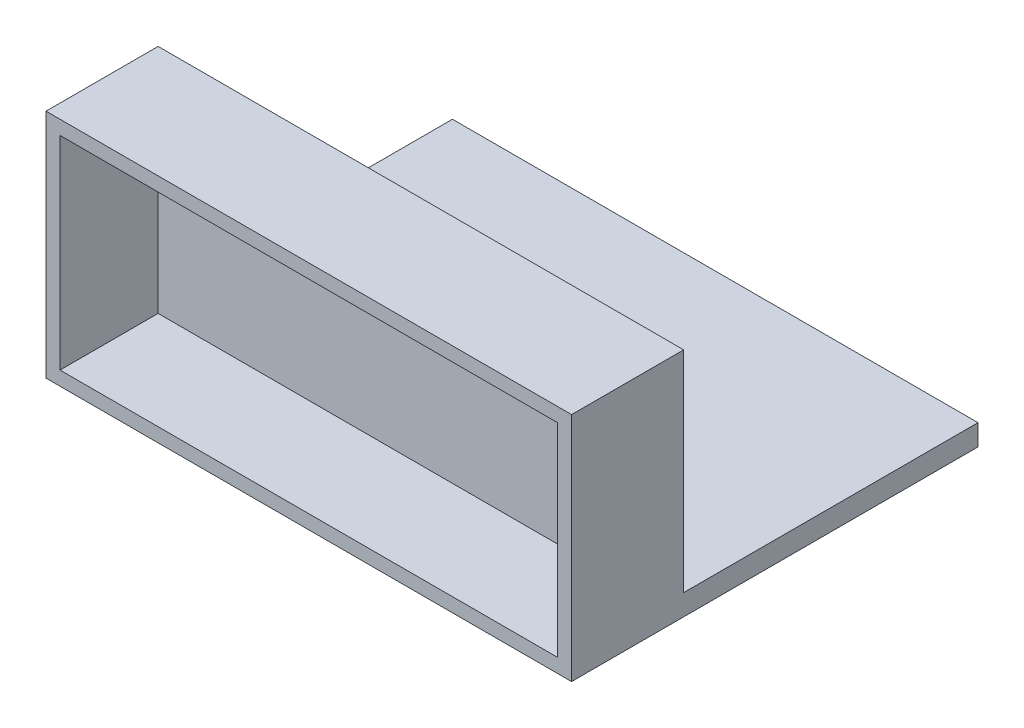
from build123d import *

# Parameters (mm, degrees)
SKETCH1_W           = 150
SKETCH1_H           = 112
BOSS_EXTRUDE1_DEPTH = 6
SKETCH3_W           = 150
SKETCH3_H           = 6
BOSS_EXTRUDE2_DEPTH = 8
SKETCH4_W           = 150
SKETCH4_H           = 4
BOSS_EXTRUDE3_DEPTH = 8
SKETCH6_W           = 150
SKETCH6_H           = 36
BOSS_EXTRUDE4_DEPTH = 60
CUT_EXTRUDE1_START  = -4
SKETCH7_W           = 150
SKETCH7_H           = 74
CUT_EXTRUDE1_DEPTH  = 4
SKETCH8_W           = 142
SKETCH8_H           = 58
CUT_EXTRUDE2_DEPTH  = 28


with BuildPart() as part:
    # Sketch1 → Boss-Extrude1 (new body)
    with BuildSketch(Plane(origin=(0, 0, 0), x_dir=(1, 0, 0), z_dir=(0, 1, 0))):
        with Locations((0, -6)):
            Rectangle(SKETCH1_W, SKETCH1_H)
    extrude(amount=BOSS_EXTRUDE1_DEPTH)

    # Sketch3 → Boss-Extrude2 (add)
    with BuildSketch(Plane.XY.offset(62)):
        with Locations((0, 3)):
            Rectangle(SKETCH3_W, SKETCH3_H)
    extrude(amount=BOSS_EXTRUDE2_DEPTH)

    # Sketch4 → Boss-Extrude3 (add)
    with BuildSketch(Plane(origin=(0, 0, 0), x_dir=(-1, 0, 0), z_dir=(0, -1, 0))):
        with Locations((0, -68)):
            Rectangle(SKETCH4_W, SKETCH4_H)
    extrude(amount=BOSS_EXTRUDE3_DEPTH)

    # Sketch6 → Boss-Extrude4 (add)
    with BuildSketch(Plane(origin=(0, 6, 0), x_dir=(1, 0, 0), z_dir=(0, 1, 0))):
        with Locations((0, -52)):
            Rectangle(SKETCH6_W, SKETCH6_H)
    extrude(amount=BOSS_EXTRUDE4_DEPTH)

    # Sketch7 → Cut-Extrude1 (cut)
    with BuildSketch(Plane.XY.offset(70).offset(CUT_EXTRUDE1_START)):
        with Locations((0, 29)):
            Rectangle(SKETCH7_W, SKETCH7_H)
    extrude(amount=CUT_EXTRUDE1_DEPTH, mode=Mode.SUBTRACT)

    # Sketch8 → Cut-Extrude2 (cut)
    with BuildSketch(Plane.XY.offset(66)):
        with Locations((0, 33)):
            Rectangle(SKETCH8_W, SKETCH8_H)
    extrude(amount=-CUT_EXTRUDE2_DEPTH, mode=Mode.SUBTRACT)


solid = part.part
